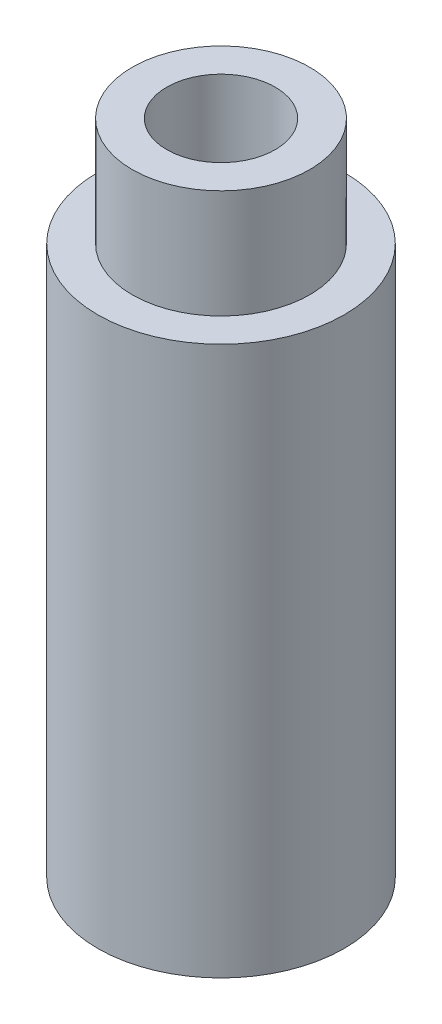
from build123d import *

# Parameters (mm, degrees)
SKETCH1_R           = 5.4
SKETCH1_R_2         = 3.3
BOSS_EXTRUDE1_DEPTH = 40
BOSS_EXTRUDE2_START = -40
SKETCH2_R           = 7.5
SKETCH2_R_2         = 3.3
BOSS_EXTRUDE2_DEPTH = 33.4


with BuildPart() as part:
    # Sketch1 → Boss-Extrude1 (new body)
    with BuildSketch(Plane(origin=(0, 0, 0), x_dir=(1, 0, 0), z_dir=(0, 1, 0))):
        with Locations(Location((0, 0, 0), (0, 0, 270))):
            Circle(SKETCH1_R)
        with Locations(Location((0, 0, 0), (0, 0, 270))):
            Circle(SKETCH1_R_2, mode=Mode.SUBTRACT)
    extrude(amount=BOSS_EXTRUDE1_DEPTH)

    # Sketch2 → Boss-Extrude2 (add)
    with BuildSketch(Plane(origin=(0, 40, 0), x_dir=(1, 0, 0), z_dir=(0, 1, 0)).offset(BOSS_EXTRUDE2_START)):
        with Locations(Location((0, 0, 0), (0, 0, 270))):
            Circle(SKETCH2_R)
        with Locations(Location((0, 0, 0), (0, 0, 270))):
            Circle(SKETCH2_R_2, mode=Mode.SUBTRACT)
    extrude(amount=BOSS_EXTRUDE2_DEPTH)


solid = part.part
